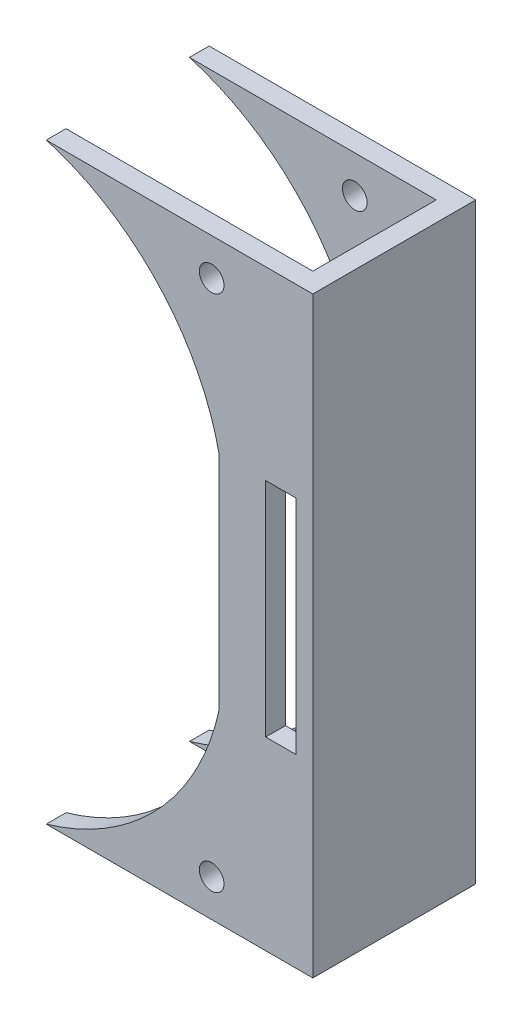
from build123d import *

# Parameters (mm, degrees)
SKETCH3_W           = 13
SKETCH3_H           = 120
BOSS_EXTRUDE1_DEPTH = 4
SKETCH11_W          = 33
SKETCH11_H          = 120
BOSS_EXTRUDE4_DEPTH = 4
SKETCH12_R          = 2.5
CUT_EXTRUDE3_DEPTH  = 76.305579191
SKETCH13_W          = 6.102814475
SKETCH13_H          = 45
CUT_EXTRUDE4_DEPTH  = 76.305579191
SKETCH15_W          = 7.5
SKETCH15_H          = 6
CUT_EXTRUDE5_DEPTH  = 74.640547644


with BuildPart() as part:
    # Sketch3 → Boss-Extrude1 (new body)
    with BuildSketch(Plane.XY):
        with Locations((20.835766423, 0)):
            Rectangle(SKETCH3_W, SKETCH3_H)
        with BuildLine():
            Line((14.335766423, 0), (14.335766423, 60))
            Line((14.335766423, 60), (-22.664233577, 60))
            ThreePointArc((-22.664233577, 60), (-0.008037132, 46.062450015), (12.335766423, 22.5))
            Line((12.335766423, 22.5), (12.335766423, 0))
            Line((12.335766423, 0), (14.335766423, 0))
        make_face()
        with BuildLine():
            Line((14.335766423, -60), (14.335766423, 0))
            Line((14.335766423, 0), (12.335766423, 0))
            Line((12.335766423, 0), (12.335766423, -22.5))
            ThreePointArc((12.335766423, -22.5), (-0.008037132, -46.062450015), (-22.664233577, -60))
            Line((-22.664233577, -60), (14.335766423, -60))
        make_face()
    extrude(amount=BOSS_EXTRUDE1_DEPTH)


with BuildPart() as body_2:
    # Mirror4: mirrored copy
    add(part.part.mirror(Plane.XY.offset(-12.5)))


with BuildPart() as part_1:
    add(part.part)

    add(body_2.part)  # Boss-Extrude4 merges body 2
    # Sketch11 → Boss-Extrude4 (add)
    with BuildSketch(Plane(origin=(27.335766423, 0, 0), x_dir=(0, 0, -1), z_dir=(1, 0, 0))):
        with Locations((12.5, 0)):
            Rectangle(SKETCH11_W, SKETCH11_H)
    extrude(amount=BOSS_EXTRUDE4_DEPTH)

    # Sketch12 → Cut-Extrude3 (cut, through all)
    with BuildSketch(Plane.XY.offset(4)):
        with Locations((10.835766423, 52.5)):
            Circle(SKETCH12_R)
    cut_extrude3 = extrude(amount=-CUT_EXTRUDE3_DEPTH, mode=Mode.SUBTRACT)

    # Mirror5: Cut-Extrude3 across plane
    add(cut_extrude3.mirror(Plane.ZX), mode=Mode.SUBTRACT)

    # Sketch13 → Cut-Extrude4 (cut, through all)
    with BuildSketch(Plane.XY.offset(4)):
        with Locations((24.835766424, 0)):
            Rectangle(SKETCH13_W, SKETCH13_H)
    extrude(amount=-CUT_EXTRUDE4_DEPTH, mode=Mode.SUBTRACT)

    # Sketch15 → Cut-Extrude5 (cut, through all)
    with BuildSketch(Plane.XY.offset(-25)):
        with Locations((18.085766423, -38.5)):
            Rectangle(SKETCH15_W, SKETCH15_H)
    extrude(amount=-CUT_EXTRUDE5_DEPTH, mode=Mode.SUBTRACT)


solid = part_1.part
